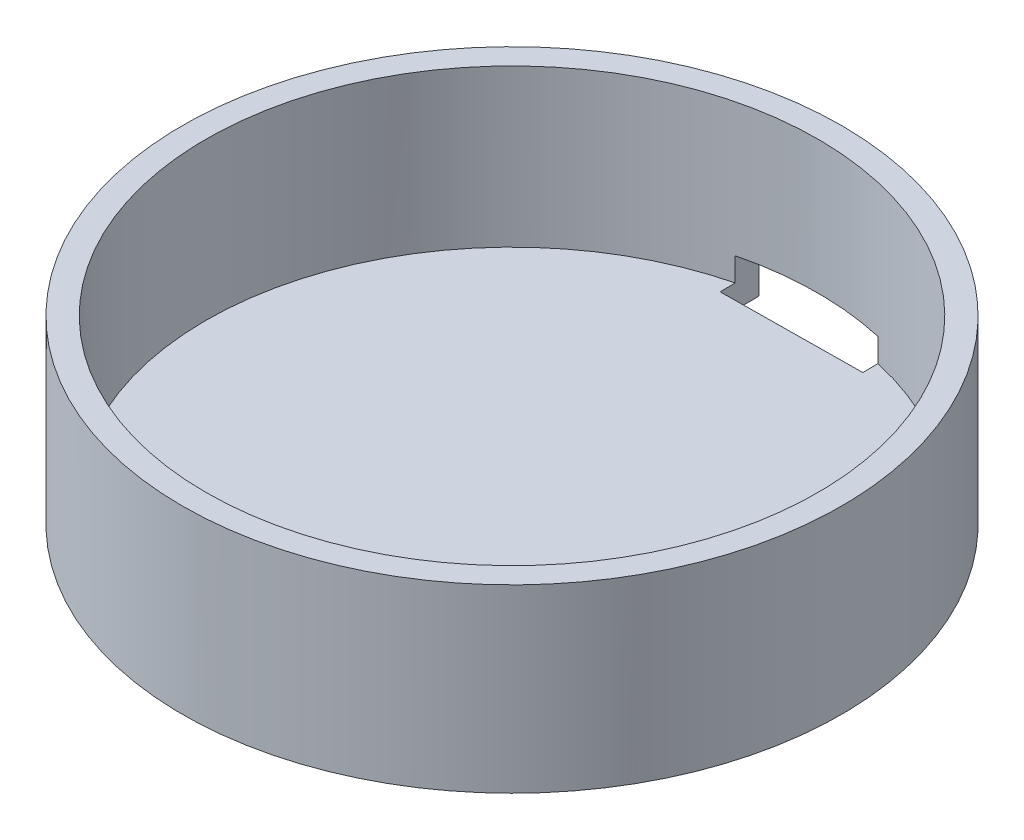
from build123d import *

# Parameters (mm, degrees)
SKETCH1_R           = 19.5
BOSS_EXTRUDE1_DEPTH = 10
SHELL1_T            = 1.5
SKETCH2_W           = 9
SKETCH2_H           = 6
CUT_EXTRUDE1_DEPTH  = 3


with BuildPart() as part:
    # Sketch1 → Boss-Extrude1 (new body)
    with BuildSketch(Plane(origin=(0, 0, 0), x_dir=(1, 0, 0), z_dir=(0, 1, 0))):
        with Locations(Location((0, 0, 0), (0, 0, 270))):
            Circle(SKETCH1_R)
    extrude(amount=BOSS_EXTRUDE1_DEPTH)

    # Shell1
    shell1_openings = [part.faces().sort_by_distance(p)[0] for p in [
        (0, 10, 0),
    ]]
    offset(amount=SHELL1_T, openings=shell1_openings, kind=Kind.INTERSECTION)

    # Sketch2 → Cut-Extrude1 (cut)
    with BuildSketch(Plane(origin=(-35.117811043, 32.6041754, -20.627520882), x_dir=(-0.9999433956533795, 0, 0.010639806821049314), z_dir=(-0.010639806821049314, 0, -0.9999433956533795))):
        with Locations((-34.896350385, -34.1041754)):
            Rectangle(SKETCH2_W, SKETCH2_H)
    extrude(amount=-CUT_EXTRUDE1_DEPTH, mode=Mode.SUBTRACT)


solid = part.part
